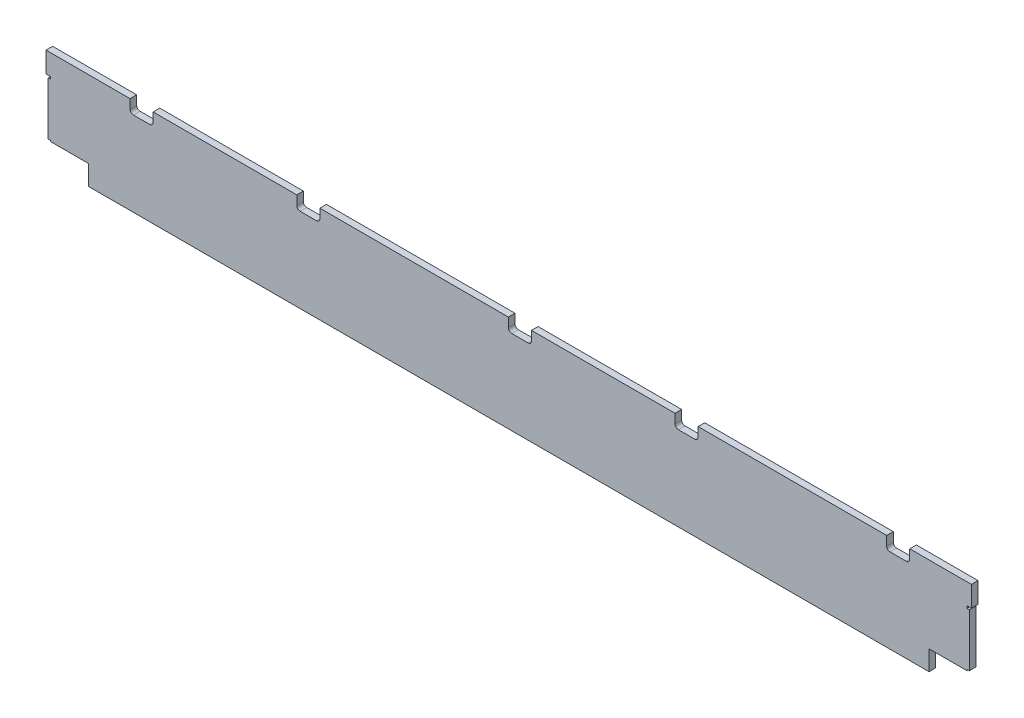
from build123d import *

# Parameters (mm, degrees)
BOSS_EXTRUDE1_DEPTH = 3.175


with BuildPart() as part:
    # Sketch2 → Boss-Extrude1 (new body)
    with BuildSketch(Plane.XY):
        with BuildLine():
            Line((-154.179179878, -203.71400002), (249.446820082, -203.714000022))
            Line((249.446820082, -203.714000022), (249.446820082, -194.181000022))
            Line((249.446820082, -194.181000022), (267.623820082, -194.181000022))
            Line((267.623820082, -194.181000022), (267.623820082, -193.665000022))
            Line((267.623820082, -193.665000022), (268.766820082, -193.665000022))
            Line((268.766820082, -193.665000022), (268.766820082, -168.265000022))
            Line((268.766820082, -168.265000022), (267.623820082, -168.265000022))
            Line((267.623820082, -168.265000022), (267.623820082, -167.122000022))
            Line((267.623820082, -167.122000022), (269.766820082, -167.122000022))
            Line((269.766820082, -167.122000022), (269.766820082, -157.216000022))
            Line((269.766820082, -157.216000022), (240.172195086, -157.216000021))
            Line((240.172195086, -157.216000021), (240.172195086, -161.66050002))
            ThreePointArc((240.172195086, -161.66050002), (239.707227101, -162.783032036), (238.584695086, -163.24800002))
            Line((238.584695086, -163.24800002), (230.695695086, -163.24800002))
            ThreePointArc((230.695695086, -163.24800002), (229.573163071, -162.783032035), (229.108195086, -161.66050002))
            Line((229.108195086, -161.66050002), (229.108195086, -157.216000021))
            Line((229.108195086, -157.216000021), (138.573445094, -157.216000021))
            Line((138.573445094, -157.216000021), (138.573445094, -161.66050002))
            ThreePointArc((138.573445094, -161.66050002), (138.108477109, -162.783032035), (136.985945094, -163.24800002))
            Line((136.985945094, -163.24800002), (129.096945094, -163.24800002))
            ThreePointArc((129.096945094, -163.24800002), (127.974413079, -162.783032035), (127.509445094, -161.66050002))
            Line((127.509445094, -161.66050002), (127.509445094, -157.216000021))
            Line((127.509445094, -157.216000021), (58.558195094, -157.216000021))
            Line((58.558195094, -157.216000021), (58.558195094, -161.66050002))
            ThreePointArc((58.558195094, -161.66050002), (58.093227109, -162.783032035), (56.970695094, -163.24800002))
            Line((56.970695094, -163.24800002), (49.081695094, -163.24800002))
            ThreePointArc((49.081695094, -163.24800002), (47.959163079, -162.783032035), (47.494195094, -161.66050002))
            Line((47.494195094, -161.66050002), (47.494195094, -157.216000021))
            Line((47.494195094, -157.216000021), (-43.040554898, -157.21600002))
            Line((-43.040554898, -157.21600002), (-43.040554898, -161.660500019))
            ThreePointArc((-43.040554898, -161.660500019), (-43.505522883, -162.783032034), (-44.628054898, -163.248000019))
            Line((-44.628054898, -163.248000019), (-52.517054898, -163.248000019))
            ThreePointArc((-52.517054898, -163.248000019), (-53.639586913, -162.783032034), (-54.104554898, -161.660500019))
            Line((-54.104554898, -161.660500019), (-54.104554898, -157.21600002))
            Line((-54.104554898, -157.21600002), (-123.055804898, -157.21600002))
            Line((-123.055804898, -157.21600002), (-123.055804898, -161.660500019))
            ThreePointArc((-123.055804898, -161.660500019), (-123.520772883, -162.783032034), (-124.643304898, -163.248000019))
            Line((-124.643304898, -163.248000019), (-132.532304898, -163.248000019))
            ThreePointArc((-132.532304898, -163.248000019), (-133.654836913, -162.783032034), (-134.119804898, -161.660500019))
            Line((-134.119804898, -161.660500019), (-134.119804898, -157.21600002))
            Line((-134.119804898, -157.21600002), (-174.499179878, -157.21600002))
            Line((-174.499179878, -157.21600002), (-174.499179878, -167.12200002))
            Line((-174.499179878, -167.12200002), (-172.356179878, -167.12200002))
            Line((-172.356179878, -167.12200002), (-172.356179878, -168.26500002))
            Line((-172.356179878, -168.26500002), (-173.499179878, -168.26500002))
            Line((-173.499179878, -168.26500002), (-173.499179878, -193.66500002))
            Line((-173.499179878, -193.66500002), (-172.356179878, -193.66500002))
            Line((-172.356179878, -193.66500002), (-172.356179878, -194.18100002))
            Line((-172.356179878, -194.18100002), (-154.179179878, -194.18100002))
            Line((-154.179179878, -194.18100002), (-154.179179878, -203.71400002))
        make_face()
    extrude(amount=BOSS_EXTRUDE1_DEPTH)


solid = part.part
